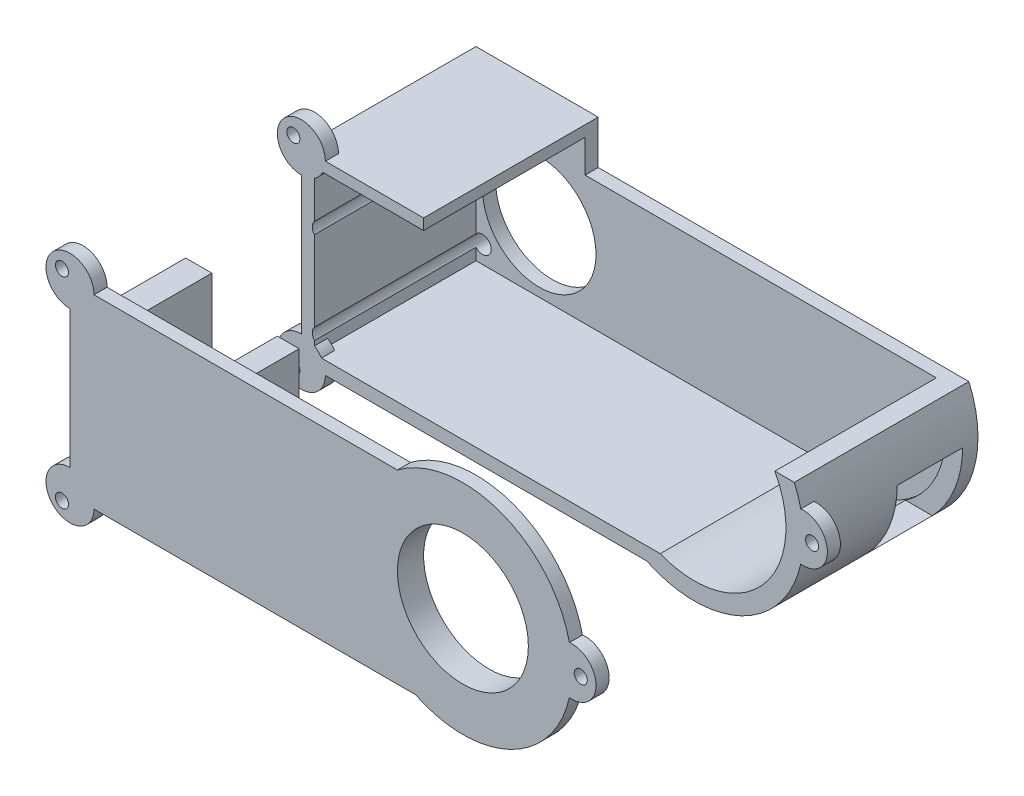
from build123d import *

# Parameters (mm, degrees)
BOSS_EXTRUDE1_DEPTH = 40
CUT_EXTRUDE1_DEPTH  = 37
CUT_EXTRUDE7_REACH  = 131.808
SKETCH4_R           = 13
CUT_EXTRUDE4_DEPTH  = 20
SKETCH14_W          = 15
SKETCH14_H          = 17
CUT_EXTRUDE12_DEPTH = 128.157382798
BOSS_EXTRUDE2_DEPTH = 3
BOSS_EXTRUDE3_DEPTH = 6
SKETCH18_W          = 17
SKETCH18_H          = 29.386957978
BOSS_EXTRUDE4_DEPTH = 6
SKETCH19_R          = 15
CUT_EXTRUDE13_DEPTH = 6
SKETCH20_R          = 5.5
SKETCH20_R_2        = 1.5
BOSS_EXTRUDE5_DEPTH = 3
SKETCH21_R          = 5.5
SKETCH21_R_2        = 1.5
BOSS_EXTRUDE6_DEPTH = 3
CUT_EXTRUDE14_START = 66
SKETCH22_R          = 21
CUT_EXTRUDE14_DEPTH = 66
SKETCH23_R          = 2
CUT_EXTRUDE15_DEPTH = 40
BOSS_EXTRUDE7_START = 20
SKETCH24_W          = 12
SKETCH24_H          = 29.386957978
BOSS_EXTRUDE7_DEPTH = 5


with BuildPart() as part:
    # Sketch1 → Boss-Extrude1 (new body)
    with BuildSketch(Plane.XY):
        with BuildLine():
            Line((0, 0), (75, 0))
            ThreePointArc((75, 0), (114.884319464, -17.597783355), (79.102752641, -42.5))
            Line((79.102752641, -42.5), (0, -42.5))
            Line((0, -42.5), (0, 0))
        make_face()
    extrude(amount=BOSS_EXTRUDE1_DEPTH)

    # Sketch2 → Cut-Extrude1 (cut)
    with BuildSketch(Plane.XY.offset(40)):
        with BuildLine():
            Line((3, -2.5), (78.391813234, -2.5))
            ThreePointArc((78.391813234, -2.5), (110.889313795, -17.846730588), (82.205771366, -39.5))
            Line((82.205771366, -39.5), (3, -39.5))
            Line((3, -39.5), (3, -2.5))
        make_face()
    extrude(amount=-CUT_EXTRUDE1_DEPTH, mode=Mode.SUBTRACT)

    # Sketch8 → Cut-Extrude7 (cut, up to next)
    with BuildSketch(Plane(origin=(0, 0, 0), x_dir=(-1, 0, 0), z_dir=(0, 0, -1)), mode=Mode.PRIVATE) as cut_extrude7_sk1:
        Polygon((-66.329094804, 0), (-28, 0), (-28, -10), (-118, -10), (-118, 0), (-118, 13.355508048), (-66.329094804, 13.355508048), align=None)
    cut_extrude7_tool1 = extrude(cut_extrude7_sk1.sketch, amount=-CUT_EXTRUDE7_REACH, mode=Mode.PRIVATE) & part.part
    add(cut_extrude7_tool1.solids().sort_by_distance((81.317312, 0.068084, 0))[0], mode=Mode.SUBTRACT)

    # Sketch4 → Cut-Extrude4 (cut)
    with BuildSketch(Plane.XY.offset(3)):
        with Locations((17.5, -24.5)):
            Circle(SKETCH4_R)
    extrude(amount=-CUT_EXTRUDE4_DEPTH, mode=Mode.SUBTRACT)

    # Sketch14 → Cut-Extrude12 (cut, through all)
    with BuildSketch(Plane(origin=(3, 0, 0), x_dir=(0, 0, -1), z_dir=(1, 0, 0))):
        with Locations((-11, -28.806469784)):
            Rectangle(SKETCH14_W, SKETCH14_H)
    extrude(amount=CUT_EXTRUDE12_DEPTH, mode=Mode.SUBTRACT)

    # Sketch21 → Boss-Extrude6 (add)
    # profile 1 of 3: a face of its own
    with BuildSketch(Plane.XY.offset(40)):
        Circle(SKETCH21_R)
        with Locations((-1.836686141, 1.5)):
            Circle(SKETCH21_R_2, mode=Mode.SUBTRACT)
    # profile 2 of 3: a face of its own
    with BuildSketch(Plane.XY.offset(40)):
        with Locations((0, -42.5)):
            Circle(SKETCH21_R)
        with Locations((-1.836686141, -44.5)):
            Circle(SKETCH21_R_2, mode=Mode.SUBTRACT)
    # profile 3 of 3: a face of its own
    with BuildSketch(Plane.XY.offset(40)):
        with Locations((115, -20)):
            Circle(SKETCH21_R)
        with Locations((117, -20)):
            Circle(SKETCH21_R_2, mode=Mode.SUBTRACT)
    extrude(amount=-BOSS_EXTRUDE6_DEPTH)

    # Sketch22 → Cut-Extrude14 (cut)
    with BuildSketch(Plane.XY.offset(3).offset(CUT_EXTRUDE14_START)):
        with Locations((90, -20)):
            Circle(SKETCH22_R)
    extrude(amount=-CUT_EXTRUDE14_DEPTH, mode=Mode.SUBTRACT)

    # Sketch23 → Cut-Extrude15 (cut)
    with BuildSketch(Plane(origin=(0, 0, 0), x_dir=(-1, 0, 0), z_dir=(0, 0, -1))):
        with Locations((-4.5, -35.5)):
            Circle(SKETCH23_R)
        with Locations((-4.5, -14.5)):
            Circle(SKETCH23_R)
    extrude(amount=-CUT_EXTRUDE15_DEPTH, mode=Mode.SUBTRACT)


with BuildPart() as body_2:
    # Sketch15 → Boss-Extrude2 (new body)
    with BuildSketch(Plane.XY.offset(90)):
        with BuildLine():
            Line((0, 0), (75, 0))
            ThreePointArc((75, 0), (114.884319464, -17.597783355), (79.102752641, -42.5))
            Line((79.102752641, -42.5), (0, -42.5))
            Line((0, -42.5), (0, 0))
        make_face()
    extrude(amount=BOSS_EXTRUDE2_DEPTH)

    # Sketch17 → Boss-Extrude3 (add)
    with BuildSketch(Plane.XY.offset(93)):
        with BuildLine():
            Line((3.5, -3), (78.365568342, -3))
            ThreePointArc((78.365568342, -3), (110.493522229, -17.908219263), (82.040100503, -39))
            Line((82.040100503, -39), (3.5, -39))
            Line((3.5, -39), (3.5, -3))
        make_face()
    extrude(amount=-BOSS_EXTRUDE3_DEPTH)

    # Sketch18 → Boss-Extrude4 (add)
    with BuildSketch(Plane.ZY.offset(-3.5)):
        with Locations((78.5, -19.891561041)):
            Rectangle(SKETCH18_W, SKETCH18_H)
    extrude(amount=-BOSS_EXTRUDE4_DEPTH)

    # Sketch19 → Cut-Extrude13 (cut)
    with BuildSketch(Plane.XY.offset(93)):
        with Locations((90, -20)):
            Circle(SKETCH19_R)
    extrude(amount=-CUT_EXTRUDE13_DEPTH, mode=Mode.SUBTRACT)

    # Sketch20 → Boss-Extrude5 (add)
    # profile 1 of 3: a face of its own
    with BuildSketch(Plane.XY.offset(93)):
        Circle(SKETCH20_R)
        with Locations((-1.836686141, 1.5)):
            Circle(SKETCH20_R_2, mode=Mode.SUBTRACT)
    # profile 2 of 3: a face of its own
    with BuildSketch(Plane.XY.offset(93)):
        with Locations((0, -42.5)):
            Circle(SKETCH20_R)
        with Locations((-1.836686141, -44.5)):
            Circle(SKETCH20_R_2, mode=Mode.SUBTRACT)
    # profile 3 of 3: a face of its own
    with BuildSketch(Plane.XY.offset(93)):
        with Locations((115, -20)):
            Circle(SKETCH20_R)
        with Locations((117, -20)):
            Circle(SKETCH20_R_2, mode=Mode.SUBTRACT)
    extrude(amount=-BOSS_EXTRUDE5_DEPTH)

    # Sketch24 → Boss-Extrude7 (add)
    with BuildSketch(Plane(origin=(9.5, 0, 0), x_dir=(0, 0, -1), z_dir=(1, 0, 0)).offset(BOSS_EXTRUDE7_START)):
        with Locations((-81, -19.891561041)):
            Rectangle(SKETCH24_W, SKETCH24_H)
    extrude(amount=BOSS_EXTRUDE7_DEPTH)


solid = Compound([part.part, body_2.part])
